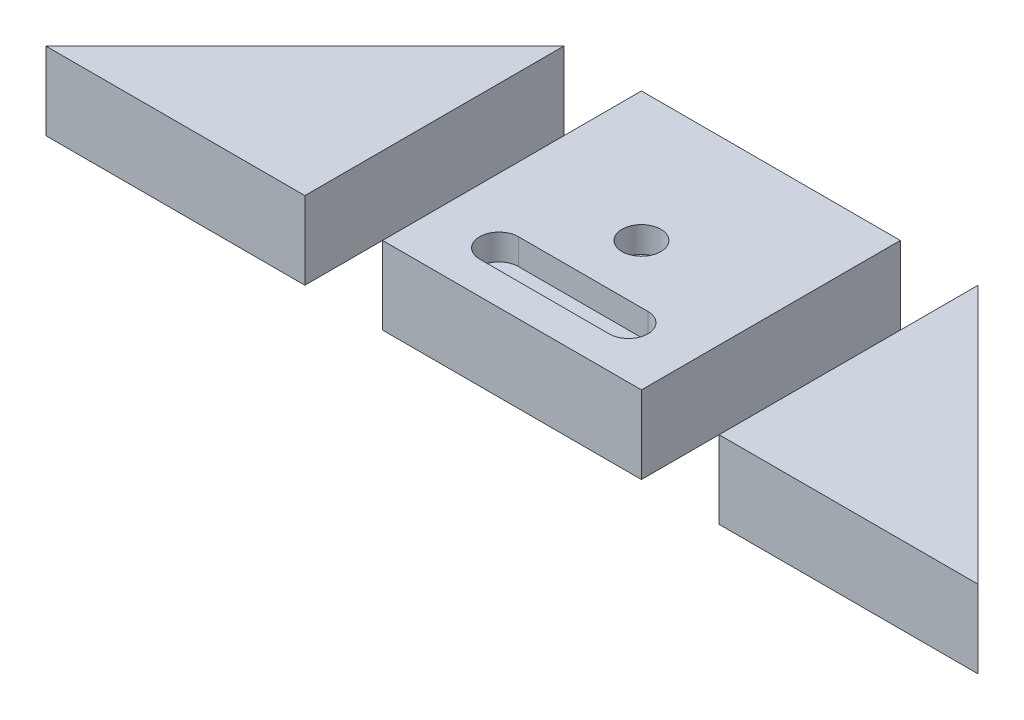
from build123d import *

# Parameters (mm, degrees)
EXTRUDE_1_DEPTH     = 30
SKETCH_1_W          = 100
SKETCH_1_H          = 100
EXTRUDE_1_2_DEPTH   = 30
SKETCH_2_R          = 7.5
CUT_EXTRUDE_1_DEPTH = 10


with BuildPart() as part:
    # 草图1 → 凸台-拉伸1 (new body)
    with BuildSketch(Plane(origin=(0, 0, 0), x_dir=(1, 0, 0), z_dir=(0, 1, 0))):
        Polygon((80, -50), (180, -50), (80, 50), align=None)
    extrude(amount=EXTRUDE_1_DEPTH)


with BuildPart() as body_2:
    # 草图1 → Extrude 1 2 (new body)
    with BuildSketch(Plane(origin=(0, 0, 0), x_dir=(1, 0, 0), z_dir=(0, 1, 0))):
        Rectangle(SKETCH_1_W, SKETCH_1_H)
    extrude(amount=EXTRUDE_1_2_DEPTH)

    # 草图2 → 切除-拉伸1 (cut)
    with BuildSketch(Plane(origin=(0, 30, 0), x_dir=(1, 0, 0), z_dir=(0, 1, 0))):
        Circle(SKETCH_2_R)
        with BuildLine():
            Line((-25, -22.5), (25, -22.5))
            ThreePointArc((25, -22.5), (32.5, -30), (25, -37.5))
            Line((25, -37.5), (-25, -37.5))
            ThreePointArc((-25, -37.5), (-32.5, -30), (-25, -22.5))
        make_face()
    extrude(amount=-CUT_EXTRUDE_1_DEPTH, mode=Mode.SUBTRACT)


with BuildPart() as body_3:
    # 镜向1: mirrored copy
    add(part.part.mirror(Plane(origin=(0, 0, 0), x_dir=(0, 0, 1), z_dir=(1, 0, 0))))


solid = Compound([part.part, body_2.part, body_3.part])
